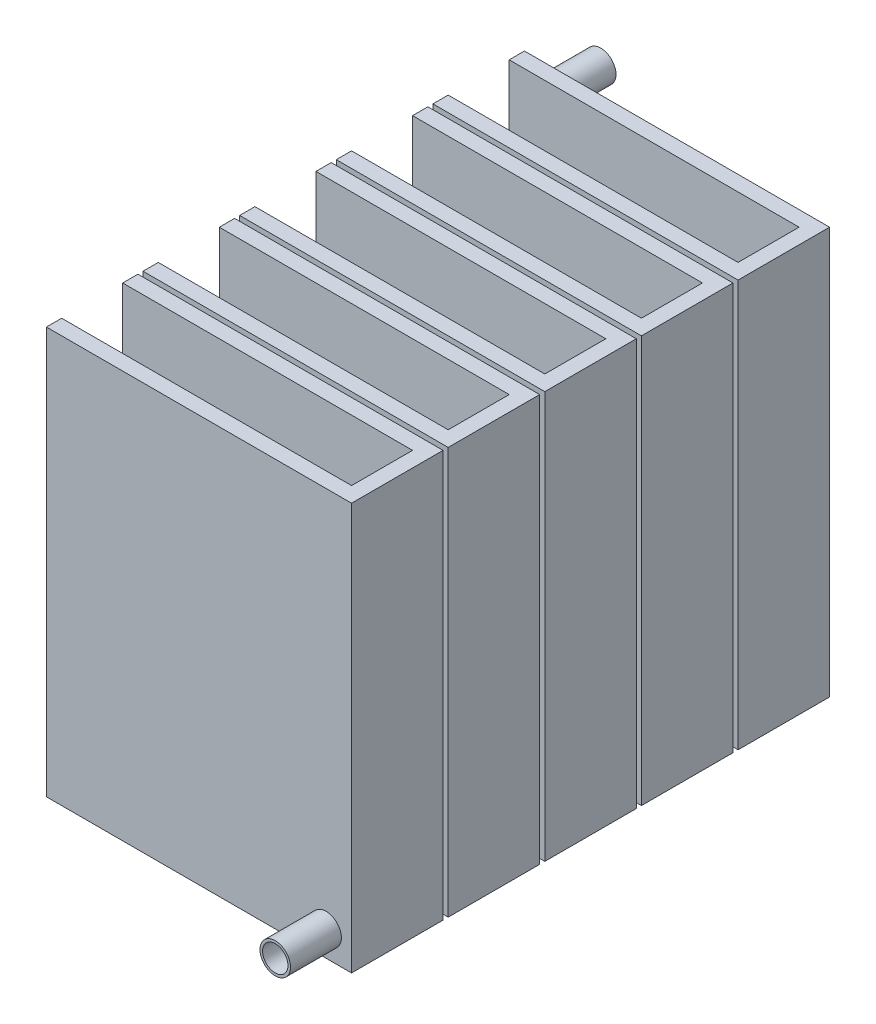
from build123d import *

# Parameters (mm, degrees)
SKETCH_1_W       = 60
SKETCH_1_H       = 80
EXTRUDE_1_DEPTH  = 3
SKETCH_2_W       = 60
SKETCH_2_H       = 80
EXTRUDE_2_DEPTH  = 3
SKETCH_4_R       = 3
EXTRUDE_5_DEPTH  = 10
SKETCH_6_R       = 3
EXTRUDE_7_DEPTH  = 1
SKETCH_7_W       = 60
SKETCH_7_H       = 80
EXTRUDE_8_DEPTH  = 3
SKETCH_10_W      = 3
SKETCH_10_H      = 80
EXTRUDE_11_DEPTH = 12
SKETCH_11_W      = 60
SKETCH_11_H      = 80
EXTRUDE_12_DEPTH = 3
SKETCH_12_W      = 3
SKETCH_12_H      = 80
EXTRUDE_13_DEPTH = 12
EXTRUDE_START    = 1
SKETCH_13_R      = 3
EXTRUDE_14_DEPTH = 1
SKETCH_14_W      = 60
SKETCH_14_H      = 80
EXTRUDE_15_DEPTH = 3
SKETCH_16_W      = 3
SKETCH_16_H      = 80
EXTRUDE_16_DEPTH = 12
SKETCH_18_W      = 60
SKETCH_18_H      = 80
EXTRUDE_17_DEPTH = 3
SKETCH_20_R      = 3
EXTRUDE_18_DEPTH = 1
SKETCH_21_W      = 60
SKETCH_21_H      = 80
EXTRUDE_19_DEPTH = 3
SKETCH_22_W      = 3
SKETCH_22_H      = 80
EXTRUDE_20_DEPTH = 12
SKETCH_23_W      = 60
SKETCH_23_H      = 80
EXTRUDE_21_DEPTH = 3
SKETCH_24_R      = 3
EXTRUDE_22_DEPTH = 1
SKETCH_25_W      = 60
SKETCH_25_H      = 80
EXTRUDE_23_DEPTH = 3
SKETCH_26_W      = 3
SKETCH_26_H      = 80
EXTRUDE_24_DEPTH = 12
SKETCH_28_W      = 60
SKETCH_28_H      = 80
EXTRUDE_25_DEPTH = 3
SKETCH_29_R      = 3
EXTRUDE_26_DEPTH = 10
SHELL_1_T        = -0.5
SHELL_2_T        = -0.5


with BuildPart() as part:
    # 草图1 → 凸台-拉伸1 (new body)
    with BuildSketch(Plane.XY):
        Rectangle(SKETCH_1_W, SKETCH_1_H)
    extrude(amount=EXTRUDE_1_DEPTH)

    # 草图4 → 凸台-拉伸5 (add)
    with BuildSketch(Plane.XY.offset(3)):
        with Locations((25, -35)):
            Circle(SKETCH_4_R)
    extrude(amount=EXTRUDE_5_DEPTH)



with BuildPart() as body_2:
    # 草图2 → 凸台-拉伸2 (new body)
    with BuildSketch(Plane(origin=(0, 0, -12), x_dir=(-1, 0, 0), z_dir=(0, 0, -1))):
        Rectangle(SKETCH_2_W, SKETCH_2_H)
    extrude(amount=EXTRUDE_2_DEPTH)


with BuildPart() as body_3:
    # 草图6 → 凸台-拉伸7 (new body)
    with BuildSketch(Plane(origin=(0, 0, -15), x_dir=(-1, 0, 0), z_dir=(0, 0, -1))):
        with Locations((25, 35)):
            Circle(SKETCH_6_R)
    extrude(amount=EXTRUDE_7_DEPTH)

    # 草图7 → 凸台-拉伸8 (add)
    with BuildSketch(Plane(origin=(0, 0, -16), x_dir=(-1, 0, 0), z_dir=(0, 0, -1))):
        Rectangle(SKETCH_7_W, SKETCH_7_H)
    extrude(amount=EXTRUDE_8_DEPTH)



with BuildPart() as part_1:
    add(part.part)

    add(body_2.part)  # 凸台-拉伸11 merges body 2
    # 草图10 → 凸台-拉伸11 (add)
    with BuildSketch(Plane.XY.offset(-12)):
        with Locations((28.5, 0)):
            Rectangle(SKETCH_10_W, SKETCH_10_H)
    extrude(amount=EXTRUDE_11_DEPTH)

    # 抽壳1
    shell_1_openings = [part_1.faces().sort_by_distance(p)[0] for p in [
        (25, -35, 13),
    ]]
    offset(amount=SHELL_1_T, openings=shell_1_openings, kind=Kind.INTERSECTION)


with BuildPart() as body_3_2:
    # 草图11 → 凸台-拉伸12 (new body)
    with BuildSketch(Plane(origin=(0, 0, -31), x_dir=(-1, 0, 0), z_dir=(0, 0, -1))):
        Rectangle(SKETCH_11_W, SKETCH_11_H)
    extrude(amount=EXTRUDE_12_DEPTH)


with BuildPart() as body_3_1:
    add(body_3.part)

    add(body_3_2.part)  # 凸台-拉伸13 merges body 3 2
    # 草图12 → 凸台-拉伸13 (add)
    with BuildSketch(Plane(origin=(0, 0, -31), x_dir=(-1, 0, 0), z_dir=(0, 0, -1))):
        with Locations((-28.5, 0)):
            Rectangle(SKETCH_12_W, SKETCH_12_H)
    extrude(amount=-EXTRUDE_13_DEPTH)

    # 草图13 → 凸台-拉伸14 (add)
    with BuildSketch(Plane(origin=(0, 0, -34), x_dir=(-1, 0, 0), z_dir=(0, 0, -1)).offset(EXTRUDE_START)):
        with Locations((-25, -35)):
            Circle(SKETCH_13_R)
    extrude(amount=-EXTRUDE_14_DEPTH)

    # 草图14 → 凸台-拉伸15 (add)
    with BuildSketch(Plane(origin=(0, 0, -35), x_dir=(-1, 0, 0), z_dir=(0, 0, -1))):
        Rectangle(SKETCH_14_W, SKETCH_14_H)
    extrude(amount=EXTRUDE_15_DEPTH)

    # 草图16 → 凸台-拉伸16 (add)
    with BuildSketch(Plane(origin=(0, 0, -38), x_dir=(-1, 0, 0), z_dir=(0, 0, -1))):
        with Locations((-28.5, 0)):
            Rectangle(SKETCH_16_W, SKETCH_16_H)
    extrude(amount=EXTRUDE_16_DEPTH)

    # 草图18 → 凸台-拉伸17 (add)
    with BuildSketch(Plane(origin=(0, 0, -50), x_dir=(-1, 0, 0), z_dir=(0, 0, -1))):
        Rectangle(SKETCH_18_W, SKETCH_18_H)
    extrude(amount=EXTRUDE_17_DEPTH)

    # 草图20 → 凸台-拉伸18 (add)
    with BuildSketch(Plane(origin=(0, 0, -53), x_dir=(-1, 0, 0), z_dir=(0, 0, -1))):
        with Locations((25, 35)):
            Circle(SKETCH_20_R)
    extrude(amount=EXTRUDE_18_DEPTH)

    # 草图21 → 凸台-拉伸19 (add)
    with BuildSketch(Plane(origin=(0, 0, -54), x_dir=(-1, 0, 0), z_dir=(0, 0, -1))):
        Rectangle(SKETCH_21_W, SKETCH_21_H)
    extrude(amount=EXTRUDE_19_DEPTH)

    # 草图22 → 凸台-拉伸20 (add)
    with BuildSketch(Plane(origin=(0, 0, -57), x_dir=(-1, 0, 0), z_dir=(0, 0, -1))):
        with Locations((-28.5, 0)):
            Rectangle(SKETCH_22_W, SKETCH_22_H)
    extrude(amount=EXTRUDE_20_DEPTH)

    # 草图23 → 凸台-拉伸21 (add)
    with BuildSketch(Plane(origin=(0, 0, -69), x_dir=(-1, 0, 0), z_dir=(0, 0, -1))):
        Rectangle(SKETCH_23_W, SKETCH_23_H)
    extrude(amount=EXTRUDE_21_DEPTH)

    # 草图24 → 凸台-拉伸22 (add)
    with BuildSketch(Plane(origin=(0, 0, -72), x_dir=(-1, 0, 0), z_dir=(0, 0, -1)).offset(EXTRUDE_START)):
        with Locations((-25, -35)):
            Circle(SKETCH_24_R)
    extrude(amount=-EXTRUDE_22_DEPTH)

    # 草图25 → 凸台-拉伸23 (add)
    with BuildSketch(Plane(origin=(0, 0, -73), x_dir=(-1, 0, 0), z_dir=(0, 0, -1))):
        Rectangle(SKETCH_25_W, SKETCH_25_H)
    extrude(amount=EXTRUDE_23_DEPTH)

    # 草图26 → 凸台-拉伸24 (add)
    with BuildSketch(Plane(origin=(0, 0, -76), x_dir=(-1, 0, 0), z_dir=(0, 0, -1))):
        with Locations((-28.5, 0)):
            Rectangle(SKETCH_26_W, SKETCH_26_H)
    extrude(amount=EXTRUDE_24_DEPTH)

    # 草图28 → 凸台-拉伸25 (add)
    with BuildSketch(Plane(origin=(0, 0, -88), x_dir=(-1, 0, 0), z_dir=(0, 0, -1))):
        Rectangle(SKETCH_28_W, SKETCH_28_H)
    extrude(amount=EXTRUDE_25_DEPTH)

    # 草图29 → 凸台-拉伸26 (add)
    with BuildSketch(Plane(origin=(0, 0, -91), x_dir=(-1, 0, 0), z_dir=(0, 0, -1))):
        with Locations((25, 35)):
            Circle(SKETCH_29_R)
    extrude(amount=EXTRUDE_26_DEPTH)

    # 抽壳2
    shell_2_openings = [body_3_1.faces().sort_by_distance(p)[0] for p in [
        (-25, 35, -101),
    ]]
    offset(amount=SHELL_2_T, openings=shell_2_openings, kind=Kind.INTERSECTION)


solid = Compound([part_1.part, body_3_1.part])
